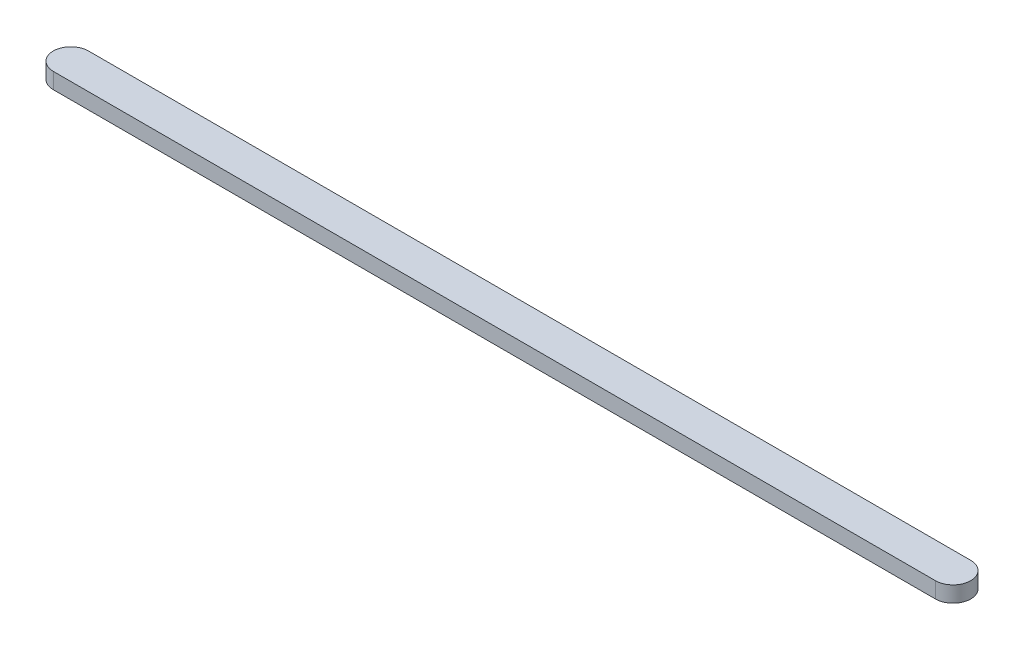
from build123d import *

# Parameters (mm, degrees)
BOSS_EXTRUDE1_DEPTH = 4.5


with BuildPart() as part:
    # Sketch1 → Boss-Extrude1 (new body)
    with BuildSketch(Plane(origin=(0, 0, 0), x_dir=(1, 0, 0), z_dir=(0, 1, 0))):
        with BuildLine():
            Line((-100, 5), (150, 5))
            ThreePointArc((150, 5), (155, 0), (150, -5))
            Line((150, -5), (-100, -5))
            ThreePointArc((-100, -5), (-105, 0), (-100, 5))
        make_face()
    extrude(amount=BOSS_EXTRUDE1_DEPTH)


solid = part.part
